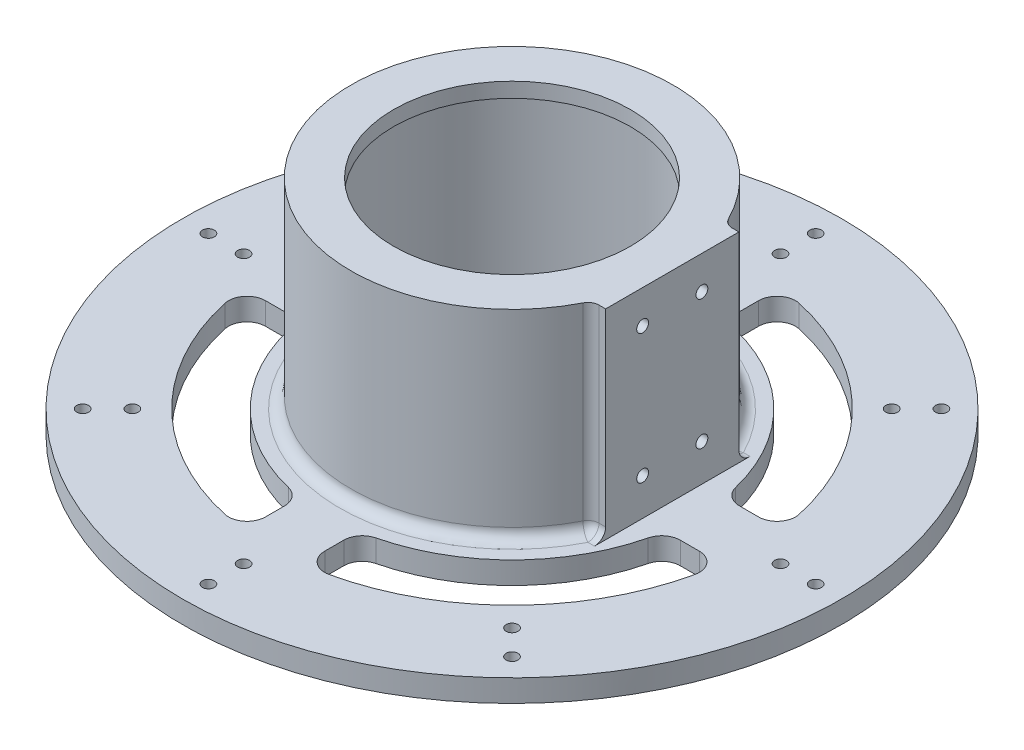
from build123d import *

# Parameters (mm, degrees)
SKETCH1_R           = 75
BOSS_EXTRUDE1_DEPTH = 6
SKETCH3_R           = 32
CUT_EXTRUDE2_DEPTH  = 226.779759943
BOSS_EXTRUDE2_DEPTH = 50
SKETCH5_R           = 1.6
CUT_EXTRUDE3_DEPTH  = 6
SKETCH7_R           = 32
BOSS_EXTRUDE4_DEPTH = 4
CUT_EXTRUDE4_DEPTH  = 6
FILLET1_R           = 3
SKETCH10_R          = 89
SKETCH10_R_2        = 75
SKETCH10_R_3        = 1.6
BOSS_EXTRUDE6_DEPTH = 6
SKETCH11_R          = 1.6
CUT_EXTRUDE6_DEPTH  = 6
FILLET3_R           = 5


with BuildPart() as part:
    # Sketch1 → Boss-Extrude1 (new body)
    with BuildSketch(Plane(origin=(0, 0, 0), x_dir=(1, 0, 0), z_dir=(0, 1, 0))):
        with Locations(Location((105.5, 60.5, 0), (0, 0, 270))):
            Circle(SKETCH1_R)
    extrude(amount=BOSS_EXTRUDE1_DEPTH)

    # Sketch3 → Cut-Extrude2 (cut, through all)
    with BuildSketch(Plane(origin=(0, 6, 0), x_dir=(1, 0, 0), z_dir=(0, 1, 0))):
        with Locations(Location((105.5, 60.5, 0), (0, 0, 270))):
            Circle(SKETCH3_R)
    extrude(amount=-CUT_EXTRUDE2_DEPTH, mode=Mode.SUBTRACT)

    # Sketch4 → Boss-Extrude2 (add)
    with BuildSketch(Plane(origin=(0, 6, 0), x_dir=(1, 0, 0), z_dir=(0, 1, 0))):
        with BuildLine():
            ThreePointArc((140.957721303, 45.5), (67, 60.5), (140.957721303, 75.5))
            Line((140.957721303, 75.5), (145.775366264, 75.5))
            Line((145.775366264, 75.5), (146.331972766, 75.5))
            ThreePointArc((146.331972766, 75.5), (145.74451839, 77.011472968), (145.101136347, 78.5))
            ThreePointArc((145.101136347, 78.5), (62, 60.5), (145.101136347, 42.5))
            ThreePointArc((145.101136347, 42.5), (145.74451839, 43.988527032), (146.331972766, 45.5))
            Line((146.331972766, 45.5), (145.775366264, 45.5))
            Line((145.775366264, 45.5), (140.957721303, 45.5))
        make_face()
        with BuildLine():
            Line((146.331972766, 75.5), (145.775366264, 75.5))
            Line((145.775366264, 75.5), (145.775366264, 45.5))
            Line((145.775366264, 45.5), (146.331972766, 45.5))
            ThreePointArc((146.331972766, 45.5), (147.885391427, 50.715900981), (148.775366264, 56.084949069))
            Line((148.775366264, 56.084949069), (148.775366264, 64.915050931))
            ThreePointArc((148.775366264, 64.915050931), (147.885391427, 70.284099019), (146.331972766, 75.5))
        make_face()
        with BuildLine():
            ThreePointArc((145.101136347, 78.5), (145.74451839, 77.011472968), (146.331972766, 75.5))
            Line((146.331972766, 75.5), (148.775366264, 75.5))
            Line((148.775366264, 75.5), (148.775366264, 78.5))
            Line((148.775366264, 78.5), (145.101136347, 78.5))
        make_face()
        with BuildLine():
            Line((148.775366264, 75.5), (146.331972766, 75.5))
            ThreePointArc((146.331972766, 75.5), (147.885391427, 70.284099019), (148.775366264, 64.915050931))
            Line((148.775366264, 64.915050931), (148.775366264, 75.5))
        make_face()
        with BuildLine():
            ThreePointArc((148.775366264, 56.084949069), (147.885391427, 50.715900981), (146.331972766, 45.5))
            Line((146.331972766, 45.5), (148.775366264, 45.5))
            Line((148.775366264, 45.5), (148.775366264, 56.084949069))
        make_face()
        with BuildLine():
            Line((148.775366264, 45.5), (146.331972766, 45.5))
            ThreePointArc((146.331972766, 45.5), (145.74451839, 43.988527032), (145.101136347, 42.5))
            Line((145.101136347, 42.5), (148.775366264, 42.5))
            Line((148.775366264, 42.5), (148.775366264, 45.5))
        make_face()
    extrude(amount=BOSS_EXTRUDE2_DEPTH)

    # Sketch5 → Cut-Extrude3 (cut)
    with BuildSketch(Plane(origin=(148.775366264, 0, 0), x_dir=(0, 0, -1), z_dir=(1, 0, 0))):
        with Locations((52.5, 51)):
            Circle(SKETCH5_R)
        with Locations((68.5, 51)):
            Circle(SKETCH5_R)
        with Locations((68.5, 16)):
            Circle(SKETCH5_R)
        with Locations((52.5, 16)):
            Circle(SKETCH5_R)
    extrude(amount=-CUT_EXTRUDE3_DEPTH, mode=Mode.SUBTRACT)

    # Sketch7 → Boss-Extrude4 (add)
    with BuildSketch(Plane(origin=(0, 56, 0), x_dir=(1, 0, 0), z_dir=(0, 1, 0))):
        with BuildLine():
            Line((145.101136347, 78.5), (148.775366264, 78.5))
            Line((148.775366264, 78.5), (148.775366264, 42.5))
            Line((148.775366264, 42.5), (145.101136347, 42.5))
            ThreePointArc((145.101136347, 42.5), (62, 60.5), (145.101136347, 78.5))
        make_face()
        with Locations(Location((105.5, 60.5, 0), (0, 0, 270))):
            Circle(SKETCH7_R, mode=Mode.SUBTRACT)
    extrude(amount=BOSS_EXTRUDE4_DEPTH)

    # Sketch8 → Cut-Extrude4 (cut)
    with BuildSketch(Plane.XZ):
        with BuildLine():
            Line((140.957721303, -45.5), (145.775366264, -45.5))
            Line((145.775366264, -45.5), (145.775366264, -75.5))
            Line((145.775366264, -75.5), (140.957721303, -75.5))
            ThreePointArc((140.957721303, -75.5), (67, -60.5), (140.957721303, -45.5))
        make_face()
    extrude(amount=-CUT_EXTRUDE4_DEPTH, mode=Mode.SUBTRACT)

    # Fillet1
    fillet1_edges = [part.edges().sort_by_distance(p)[0] for p in [
        (146.938251306, 6, -42.5),
        (145.101136347, 31, -42.5),
        (62, 6, -60.5),
        (145.101136347, 31, -78.5),
        (146.938251306, 6, -78.5),
    ]]
    fillet(fillet1_edges, radius=FILLET1_R)

    # Sketch10 → Boss-Extrude6 (add)
    with BuildSketch(Plane.XZ):
        with Locations(Location((105.5, -60.5, 0), (0, 0, 270))):
            Circle(SKETCH10_R)
        with Locations((105.5, -60.5)):
            Circle(SKETCH10_R_2, mode=Mode.SUBTRACT)
        with Locations(Location((105.5, 21.5, 0), (0, 0, 270))):
            Circle(SKETCH10_R_3, mode=Mode.SUBTRACT)
        with Locations(Location((163.482756057, -2.517243943, 0), (0, 0, 270))):
            Circle(SKETCH10_R_3, mode=Mode.SUBTRACT)
        with Locations(Location((187.5, -60.5, 0), (0, 0, 270))):
            Circle(SKETCH10_R_3, mode=Mode.SUBTRACT)
        with Locations(Location((163.482756057, -118.482756057, 0), (0, 0, 270))):
            Circle(SKETCH10_R_3, mode=Mode.SUBTRACT)
        with Locations(Location((105.5, -142.5, 0), (0, 0, 270))):
            Circle(SKETCH10_R_3, mode=Mode.SUBTRACT)
        with Locations(Location((47.517243943, -118.482756057, 0), (0, 0, 270))):
            Circle(SKETCH10_R_3, mode=Mode.SUBTRACT)
        with Locations(Location((23.5, -60.5, 0), (0, 0, 270))):
            Circle(SKETCH10_R_3, mode=Mode.SUBTRACT)
        with Locations(Location((47.517243943, -2.517243943, 0), (0, 0, 270))):
            Circle(SKETCH10_R_3, mode=Mode.SUBTRACT)
    extrude(amount=-BOSS_EXTRUDE6_DEPTH)

    # Sketch11 → Cut-Extrude6 (cut)
    with BuildSketch(Plane.XZ):
        with BuildLine():
            ThreePointArc((97.5, -11.144149283), (70.144660941, -25.144660941), (56.144149283, -52.5))
            Line((56.144149283, -52.5), (40.994186309, -52.5))
            ThreePointArc((40.994186309, -52.5), (59.538059223, -14.538059223), (97.5, 4.005813691))
            Line((97.5, 4.005813691), (97.5, -11.144149283))
        make_face()
        with BuildLine():
            ThreePointArc((154.855850717, -52.5), (140.855339059, -25.144660941), (113.5, -11.144149283))
            Line((113.5, -11.144149283), (113.5, 4.005813691))
            ThreePointArc((113.5, 4.005813691), (151.461940777, -14.538059223), (170.005813691, -52.5))
            Line((170.005813691, -52.5), (154.855850717, -52.5))
        make_face()
        with BuildLine():
            Line((113.5, -125.005813691), (113.5, -109.855850717))
            ThreePointArc((113.5, -109.855850717), (140.855339059, -95.855339059), (154.855850717, -68.5))
            Line((154.855850717, -68.5), (170.005813691, -68.5))
            ThreePointArc((170.005813691, -68.5), (151.461940777, -106.461940777), (113.5, -125.005813691))
        make_face()
        with BuildLine():
            Line((40.994186309, -68.5), (56.144149283, -68.5))
            ThreePointArc((56.144149283, -68.5), (70.144660941, -95.855339059), (97.5, -109.855850717))
            Line((97.5, -109.855850717), (97.5, -125.005813691))
            ThreePointArc((97.5, -125.005813691), (59.538059223, -106.461940777), (40.994186309, -68.5))
        make_face()
        with Locations(Location((156.765241636, -111.765241636, 0), (0, 0, 270))):
            Circle(SKETCH11_R)
        with Locations(Location((178, -60.5, 0), (0, 0, 270))):
            Circle(SKETCH11_R)
        with Locations(Location((156.765241636, -9.234758364, 0), (0, 0, 270))):
            Circle(SKETCH11_R)
        with Locations(Location((105.5, 12, 0), (0, 0, 270))):
            Circle(SKETCH11_R)
        with Locations(Location((54.234758364, -9.234758364, 0), (0, 0, 270))):
            Circle(SKETCH11_R)
        with Locations(Location((33, -60.5, 0), (0, 0, 270))):
            Circle(SKETCH11_R)
        with Locations(Location((54.234758364, -111.765241636, 0), (0, 0, 270))):
            Circle(SKETCH11_R)
        with Locations(Location((105.5, -133, 0), (0, 0, 270))):
            Circle(SKETCH11_R)
    extrude(amount=-CUT_EXTRUDE6_DEPTH, mode=Mode.SUBTRACT)

    # Fillet3
    fillet3_edges = [part.edges().sort_by_distance(p)[0] for p in [
        (170.005813691, 3, -52.5),
        (113.5, 3, 4.005813691),
        (113.5, 3, -11.144149283),
        (154.855850717, 3, -52.5),
        (170.005813691, 3, -68.5),
        (154.855850717, 3, -68.5),
        (113.5, 3, -109.855850717),
        (113.5, 3, -125.005813691),
        (97.5, 3, -125.005813691),
        (97.5, 3, -109.855850717),
        (56.144149283, 3, -68.5),
        (40.994186309, 3, -68.5),
        (97.5, 3, 4.005813691),
        (40.994186309, 3, -52.5),
        (56.144149283, 3, -52.5),
        (97.5, 3, -11.144149283),
    ]]
    fillet(fillet3_edges, radius=FILLET3_R)


solid = part.part
